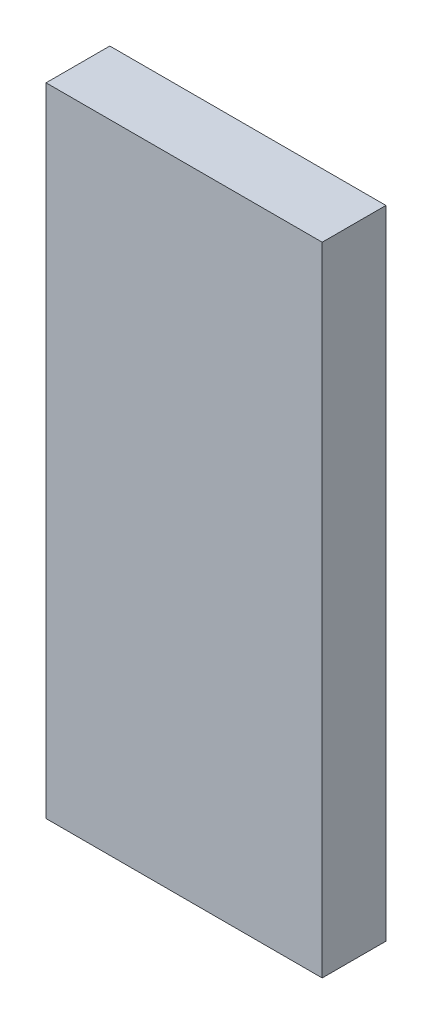
from build123d import *

# Parameters (mm, degrees)
ESQUISSE1_W             = 13
ESQUISSE1_H             = 30
BOSS_EXTRU_1_DEPTH      = 4
ESQUISSE1_4_R           = 5.05
ENL_V_MAT_EXTRU_1_DEPTH = 1.9
CHANFREIN1_SIZE         = 1


with BuildPart() as part:
    # Esquisse1 → Boss.-Extru.1 (new body)
    with BuildSketch(Plane.XY):
        Rectangle(ESQUISSE1_W, ESQUISSE1_H)
    extrude(amount=BOSS_EXTRU_1_DEPTH)

    # Esquisse1<4> → Enlèv. mat.-Extru.1 (cut)
    with BuildSketch(Plane.XY):
        Circle(ESQUISSE1_4_R)
    extrude(amount=ENL_V_MAT_EXTRU_1_DEPTH, mode=Mode.SUBTRACT)

    # Chanfrein1
    chanfrein1_edges = [part.edges().sort_by_distance(p)[0] for p in [
        (0, 15, 0),
        (-6.5, 0, 0),
        (0, -15, 0),
        (6.5, 0, 0),
    ]]
    chamfer(chanfrein1_edges, length=CHANFREIN1_SIZE)


solid = part.part
